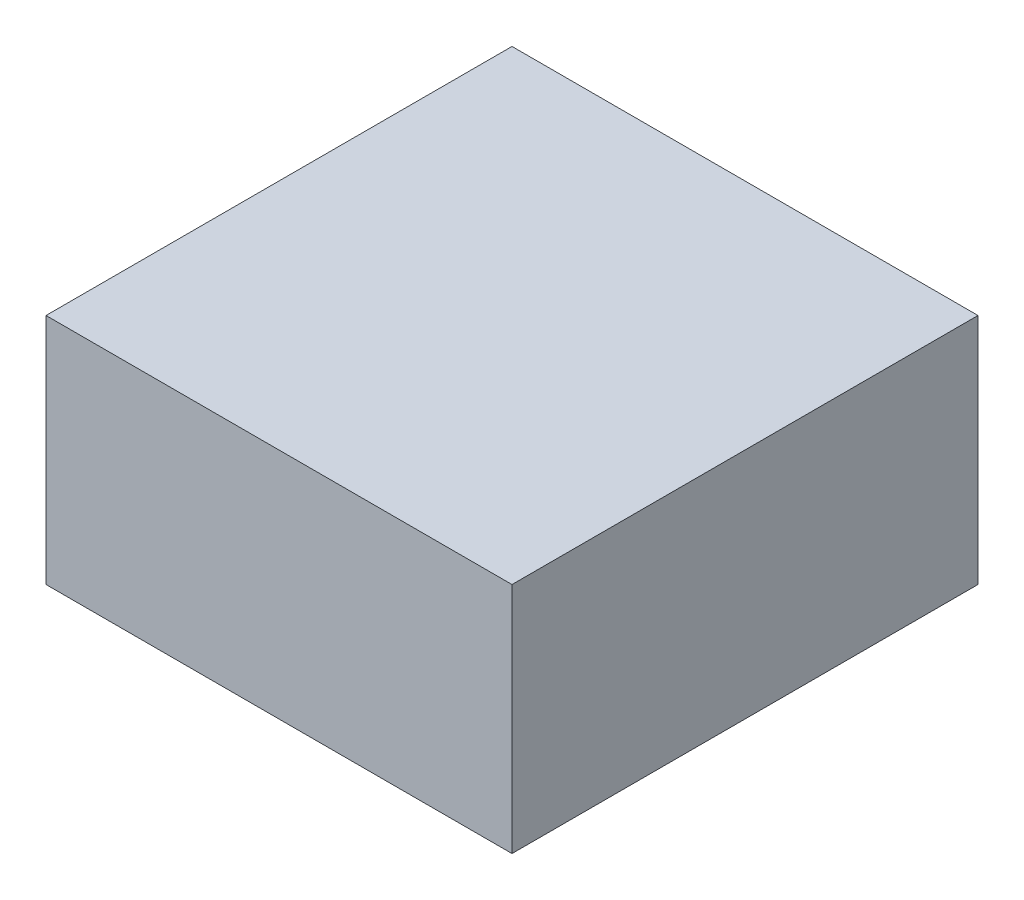
from build123d import *

# Parameters (mm, degrees)
SKETCH2_W           = 500
SKETCH2_H           = 500
BOSS_EXTRUDE1_DEPTH = 250


with BuildPart() as part:
    # Sketch2 → Boss-Extrude1 (new body)
    with BuildSketch(Plane(origin=(0, 0, 0), x_dir=(1, 0, 0), z_dir=(0, 1, 0))):
        Rectangle(SKETCH2_W, SKETCH2_H)
    extrude(amount=BOSS_EXTRUDE1_DEPTH)


solid = part.part
